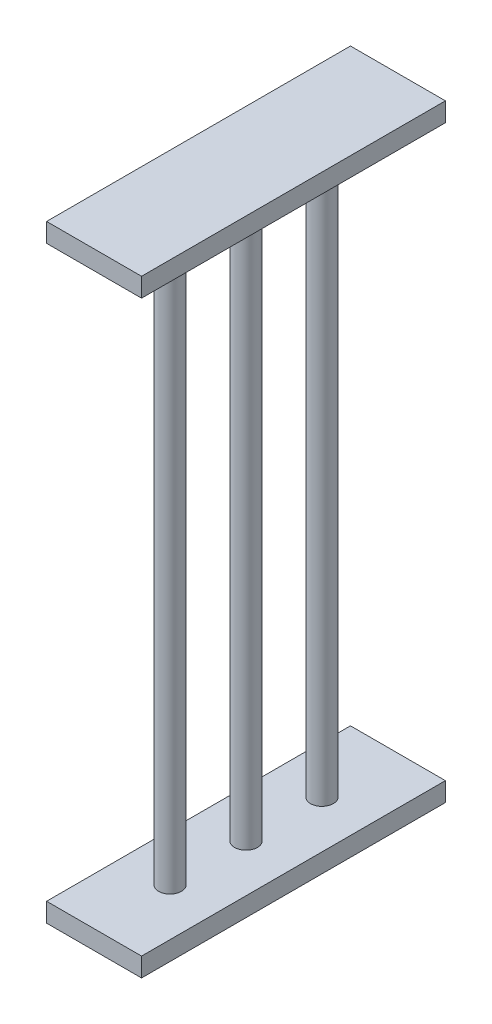
from build123d import *

# Parameters (mm, degrees)
SKETCH_1_W      = 50
SKETCH_1_H      = 160
EXTRUDE_1_DEPTH = 10
SKETCH_2_R      = 6
EXTRUDE_2_DEPTH = 300
SKETCH_3_W      = 50
SKETCH_3_H      = 160
EXTRUDE_3_DEPTH = 10


with BuildPart() as part:
    # 草图1 → 凸台-拉伸1 (new body)
    with BuildSketch(Plane(origin=(0, 0, 0), x_dir=(1, 0, 0), z_dir=(0, 1, 0))):
        with Locations((-25, 80)):
            Rectangle(SKETCH_1_W, SKETCH_1_H)
    extrude(amount=EXTRUDE_1_DEPTH)

    # 草图2 → 凸台-拉伸2 (add)
    with BuildSketch(Plane(origin=(0, 10, 0), x_dir=(1, 0, 0), z_dir=(0, 1, 0))):
        with Locations(Location((-25, 120, 0), (0, 0, 270))):
            Circle(SKETCH_2_R)
        with Locations(Location((-25, 80, 0), (0, 0, 270))):
            Circle(SKETCH_2_R)
        with Locations(Location((-25, 40, 0), (0, 0, 270))):
            Circle(SKETCH_2_R)
    extrude(amount=EXTRUDE_2_DEPTH)

    # 草图3 → 凸台-拉伸3 (add)
    with BuildSketch(Plane(origin=(0, 310, 0), x_dir=(1, 0, 0), z_dir=(0, 1, 0))):
        with Locations((-25, 80)):
            Rectangle(SKETCH_3_W, SKETCH_3_H)
    extrude(amount=EXTRUDE_3_DEPTH)


solid = part.part
